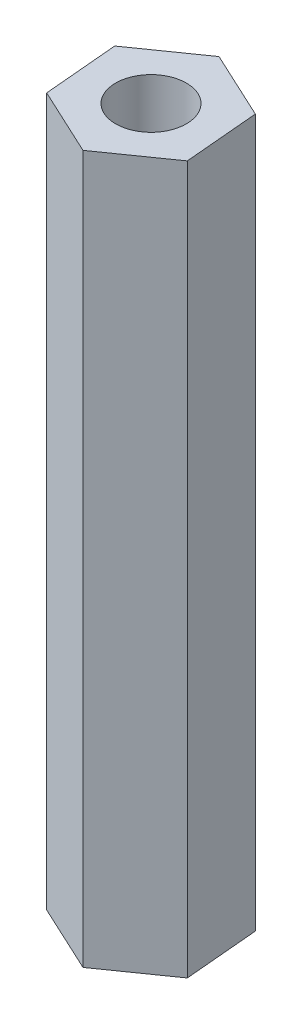
from build123d import *

# Parameters (mm, degrees)
SKETCH_1_R      = 1.5
EXTRUDE_1_DEPTH = 30


with BuildPart() as part:
    # 草图1 → 凸台-拉伸1 (new body)
    with BuildSketch(Plane(origin=(0, 0, 0), x_dir=(1, 0, 0), z_dir=(0, 1, 0))):
        Polygon((2.878837483, -1.340010477), (2.599901856, 1.823141156), (-0.278935628, 3.163151632), (-2.878837483, 1.340010477), (-2.599901856, -1.823141156), (0.278935628, -3.163151632), align=None)
        with Locations(Location((0, 0, 0), (0, 0, 270))):
            Circle(SKETCH_1_R, mode=Mode.SUBTRACT)
    extrude(amount=EXTRUDE_1_DEPTH)


solid = part.part
